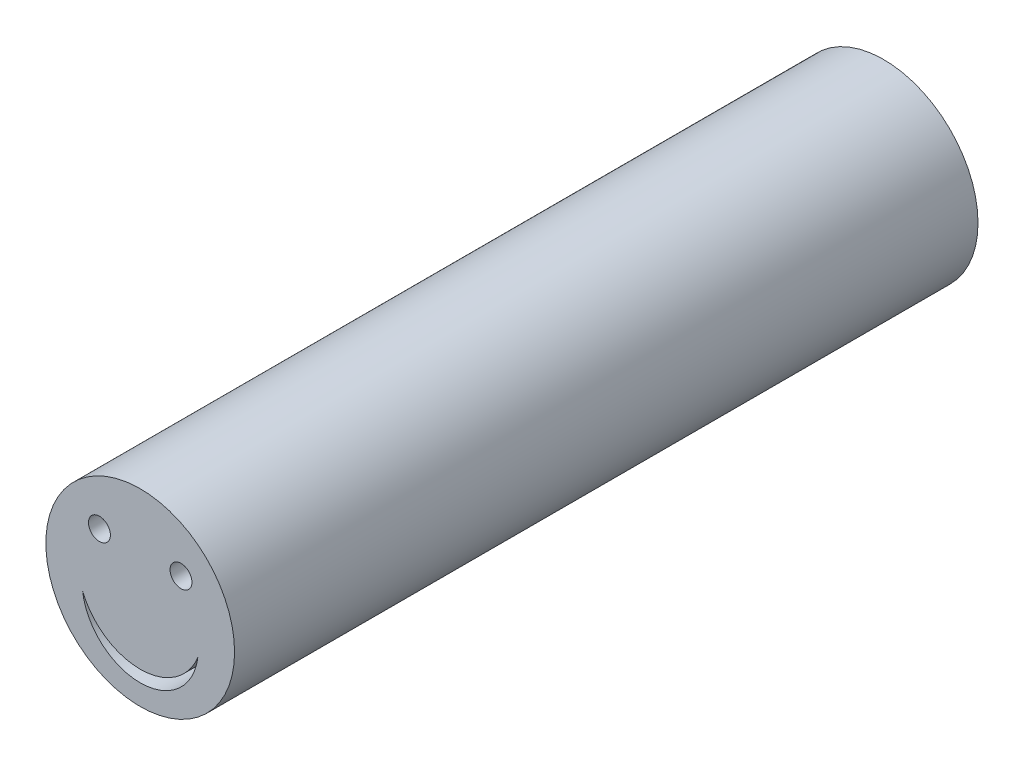
from build123d import *

# Parameters (mm, degrees)
SKETCH1_R               = 35.5406
BOSS_EXTRUDE1_DEPTH     = 140
CUT_EXTRUDE1_DEPTH      = 285.475426877
CUT_EXTRUDE1_DEPTH_BACK = 285.475426877
SKETCH3_R               = 4.131775048


with BuildPart() as part:
    # Sketch1 → Boss-Extrude1 (new, symmetric)
    with BuildSketch(Plane.XY):
        Circle(SKETCH1_R)
    extrude(amount=BOSS_EXTRUDE1_DEPTH, both=True)

    # Sketch3 → Cut-Extrude1 (cut, two sides: drawn at the far end of the back side and taken through both)
    with BuildSketch(Plane.XY.offset(140).offset(-CUT_EXTRUDE1_DEPTH_BACK)):
        with Locations((-15.363902822, 14.74340124)):
            Circle(SKETCH3_R)
        with Locations((15.363902822, 14.74340124)):
            Circle(SKETCH3_R)
        with BuildLine():
            ThreePointArc((-21.71870656, -8.592271503), (0, -23.356569616), (21.71870656, -8.592271503))
            ThreePointArc((21.71870656, -8.592271503), (0, -27.784875685), (-21.71870656, -8.592271503))
        make_face()
    extrude(amount=CUT_EXTRUDE1_DEPTH + CUT_EXTRUDE1_DEPTH_BACK, mode=Mode.SUBTRACT)


solid = part.part
